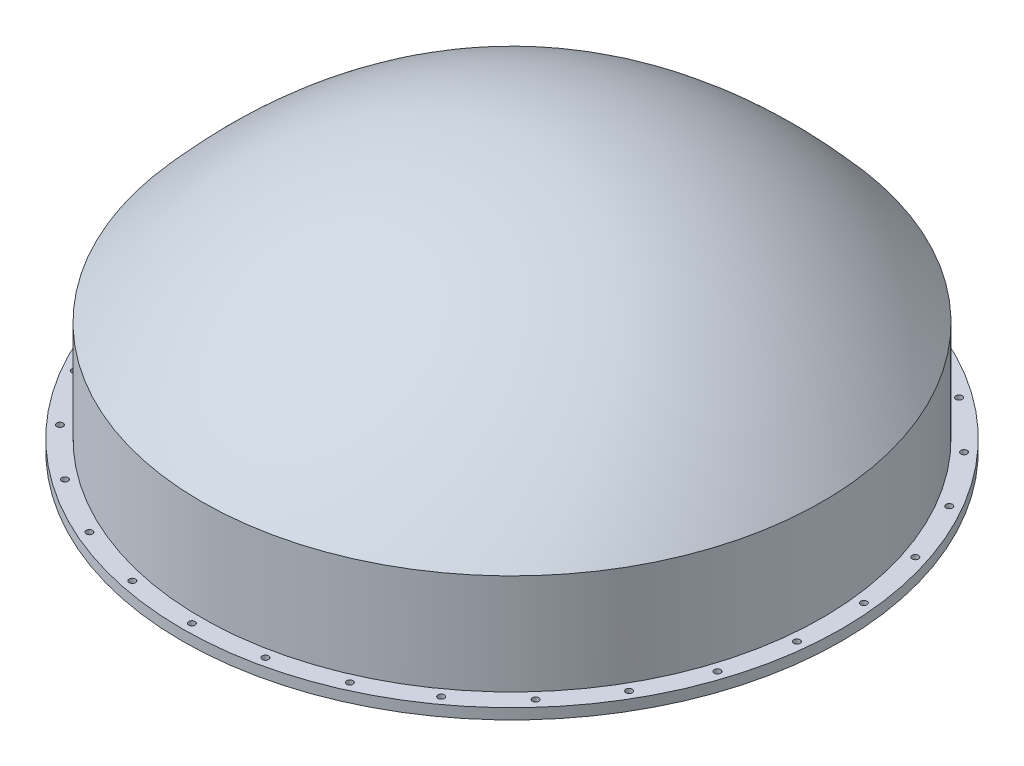
from build123d import *

# Parameters (mm, degrees)
SKETCH2_R          = 22
CUT_EXTRUDE1_DEPTH = 73


with BuildPart() as part:
    # Sketch1 → Revolve1 (revolve)
    with BuildSketch(Plane(origin=(0, 0, 0), x_dir=(0, 0, -1), z_dir=(1, 0, 0)), mode=Mode.PRIVATE) as revolve1_sk:
        with BuildLine():
            Line((-2081.13, 0), (-2081.13, -744.115))
            Line((-2081.13, -744.115), (-2262.02, -744.115))
            Line((-2262.02, -744.115), (-2262.02, -671.115))
            Line((-2262.02, -671.115), (-2130.02, -671.115))
            Line((-2130.02, -671.115), (-2130.02, 18.415372076))
            add(Edge.make_bspline(
                [(0, 1093.3), (-111.945674729, 1093.301964169), (-331.549711188, 1074.332200736), (-582.656555599, 1030.041438516), (-861.641512528, 945.67320197), (-1132.404227913, 827.653731699), (-1394.784318246, 676.14164624), (-1616.963153693, 514.420185996), (-1771.693030405, 383.360606327), (-1878.156335698, 284.381935555), (-1953.214672008, 209.812058966), (-2005.296009742, 155.808339202), (-2042.251263633, 116.267998019), (-2068.005468178, 88.138958469), (-2086.339931254, 67.805498907), (-2099.145942337, 53.458924443), (-2108.276321328, 43.152645167), (-2114.666386739, 35.903586551), (-2119.208174357, 30.731122283), (-2125.509674702, 23.552924448), (-2130.02, 18.415372076)],
                knots=[0, 0, 0, 0.094371124, 0.188742248, 0.314570414, 0.440398579, 0.566226745, 0.69205491, 0.786426034, 0.849340117, 0.896525679, 0.92798272, 0.951575501, 0.967304022, 0.979100413, 0.986964673, 0.992862868, 0.996794998, 0.999744096, 1.001710161, 1.006625324, 1.006625324, 1.006625324], degree=2))
            Line((0, 1093.3), (0, 1044.41))
            add(Edge.make_bspline(
                [(0, 1044.41), (-1164.248075476, 1044.41), (-2081.13, 0)],
                knots=[0, 0, 0, 1, 1, 1], degree=2))
        make_face()
    revolve(revolve1_sk.sketch.rotate(Axis((0, 0, 0), (0, 1, 0)), 180), axis=Axis((0, 0, 0), (0, 1, 0)))

    # Sketch2 → Cut-Extrude1 (cut)
    with BuildSketch(Plane.XZ.offset(744.115)):
        with Locations(Location((0, 2196.0235, 0), (0, 0, 270))):
            Circle(SKETCH2_R)
        with Locations(Location((456.578958961, 2148.03511768, 0), (0, 0, 270))):
            Circle(SKETCH2_R)
        with Locations(Location((893.203226506, 2006.167293301, 0), (0, 0, 270))):
            Circle(SKETCH2_R)
        with Locations(Location((1290.790226988, 1776.620331547, 0), (0, 0, 270))):
            Circle(SKETCH2_R)
        with Locations(Location((1631.963500652, 1469.426536133, 0), (0, 0, 270))):
            Circle(SKETCH2_R)
        with Locations(Location((1901.812138308, 1098.01175, 0), (0, 0, 270))):
            Circle(SKETCH2_R)
        with Locations(Location((2088.542459612, 678.608581547, 0), (0, 0, 270))):
            Circle(SKETCH2_R)
        with Locations(Location((2183.993453493, 229.546961755, 0), (0, 0, 270))):
            Circle(SKETCH2_R)
        with Locations(Location((2183.993453493, -229.546961755, 0), (0, 0, 270))):
            Circle(SKETCH2_R)
        with Locations(Location((2088.542459612, -678.608581547, 0), (0, 0, 270))):
            Circle(SKETCH2_R)
        with Locations(Location((1901.812138308, -1098.01175, 0), (0, 0, 270))):
            Circle(SKETCH2_R)
        with Locations(Location((1631.963500652, -1469.426536133, 0), (0, 0, 270))):
            Circle(SKETCH2_R)
        with Locations(Location((1290.790226988, -1776.620331547, 0), (0, 0, 270))):
            Circle(SKETCH2_R)
        with Locations(Location((893.203226506, -2006.167293301, 0), (0, 0, 270))):
            Circle(SKETCH2_R)
        with Locations(Location((456.578958961, -2148.03511768, 0), (0, 0, 270))):
            Circle(SKETCH2_R)
        with Locations(Location((0, -2196.0235, 0), (0, 0, 270))):
            Circle(SKETCH2_R)
        with Locations(Location((-456.57895896, -2148.03511768, 0), (0, 0, 270))):
            Circle(SKETCH2_R)
        with Locations(Location((-893.203226505, -2006.167293301, 0), (0, 0, 270))):
            Circle(SKETCH2_R)
        with Locations(Location((-1290.790226988, -1776.620331547, 0), (0, 0, 270))):
            Circle(SKETCH2_R)
        with Locations(Location((-1631.963500652, -1469.426536133, 0), (0, 0, 270))):
            Circle(SKETCH2_R)
        with Locations(Location((-1901.812138307, -1098.01175, 0), (0, 0, 270))):
            Circle(SKETCH2_R)
        with Locations(Location((-2088.542459612, -678.608581547, 0), (0, 0, 270))):
            Circle(SKETCH2_R)
        with Locations(Location((-2183.993453493, -229.546961755, 0), (0, 0, 270))):
            Circle(SKETCH2_R)
        with Locations(Location((-2183.993453493, 229.546961755, 0), (0, 0, 270))):
            Circle(SKETCH2_R)
        with Locations(Location((-2088.542459612, 678.608581547, 0), (0, 0, 270))):
            Circle(SKETCH2_R)
        with Locations(Location((-1901.812138308, 1098.01175, 0), (0, 0, 270))):
            Circle(SKETCH2_R)
        with Locations(Location((-1631.963500652, 1469.426536133, 0), (0, 0, 270))):
            Circle(SKETCH2_R)
        with Locations(Location((-1290.790226988, 1776.620331547, 0), (0, 0, 270))):
            Circle(SKETCH2_R)
        with Locations(Location((-893.203226506, 2006.167293301, 0), (0, 0, 270))):
            Circle(SKETCH2_R)
        with Locations(Location((-456.578958961, 2148.03511768, 0), (0, 0, 270))):
            Circle(SKETCH2_R)
    extrude(amount=-CUT_EXTRUDE1_DEPTH, mode=Mode.SUBTRACT)


solid = part.part
